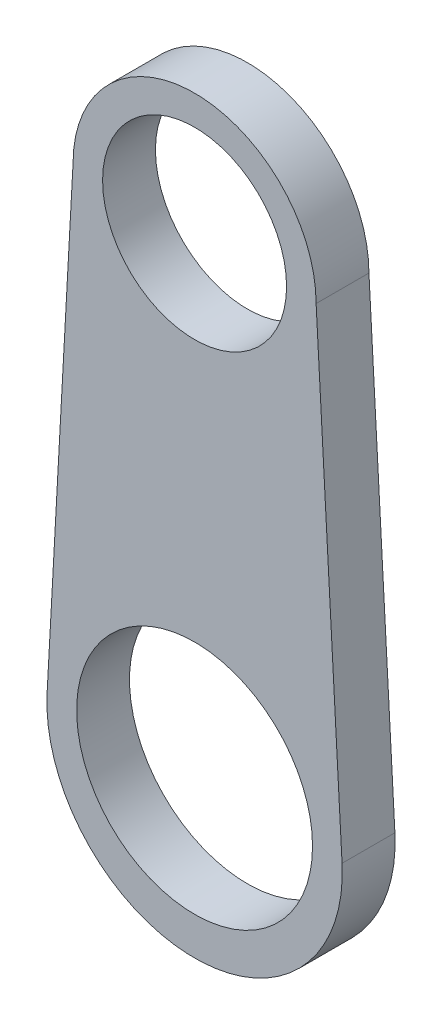
from build123d import *

# Parameters (mm, degrees)
SKETCH1_R           = 9.906
SKETCH1_R_2         = 12.7
BOSS_EXTRUDE1_DEPTH = 5.6896


with BuildPart() as part:
    # Sketch1 → Boss-Extrude1 (new body)
    with BuildSketch(Plane.XY):
        with BuildLine():
            ThreePointArc((-13.085798561, 50.8), (0, 63.885798561), (13.085798561, 50.8))
            Line((13.085798561, 50.8), (15.879798561, 0))
            ThreePointArc((15.879798561, 0), (0, -16.777187541), (-15.879798561, 0))
            Line((-15.879798561, 0), (-13.085798561, 50.8))
        make_face()
        with Locations((0, 50.8)):
            Circle(SKETCH1_R, mode=Mode.SUBTRACT)
        Circle(SKETCH1_R_2, mode=Mode.SUBTRACT)
    extrude(amount=BOSS_EXTRUDE1_DEPTH)


solid = part.part
